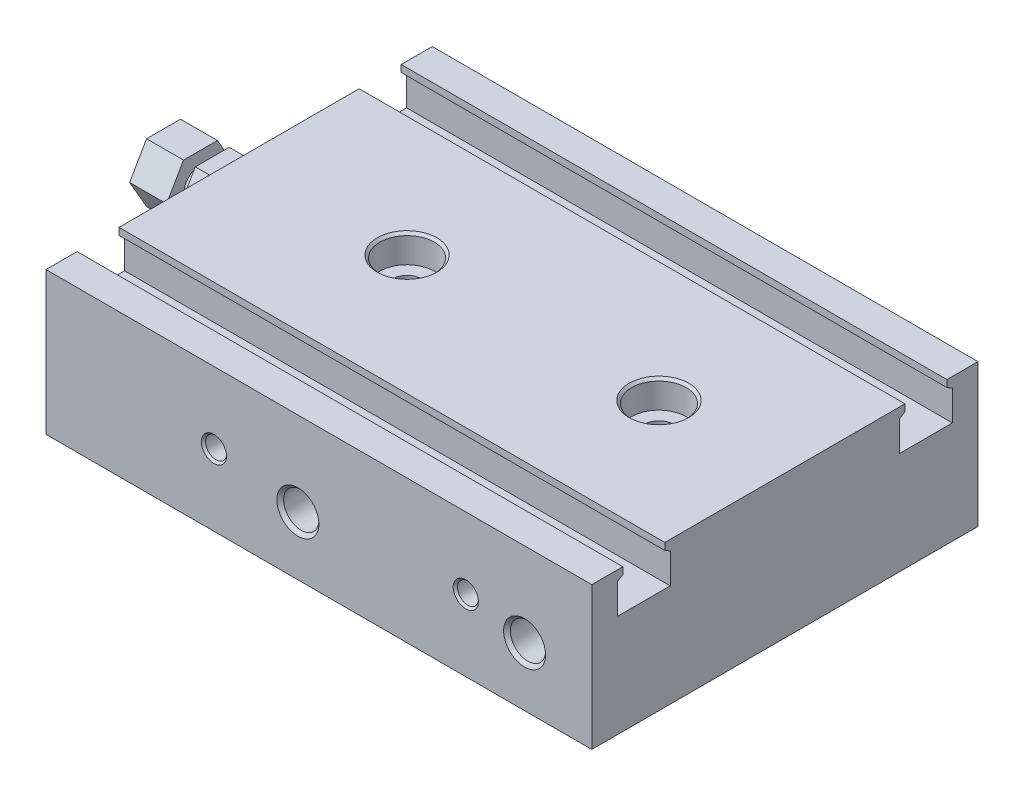
from build123d import *

# Parameters (mm, degrees)
BODY_SKETCH_W                                = 46
BODY_SKETCH_H                                = 17
BODY_DEPTH                                   = 65
BODY_ROD_HOLES_SKETCH_R                      = 3
BODY_ROD_HOLES_DEPTH                         = 10
BODY_PISTON_HOLES_SKETCH_R                   = 4.05
BODY_PISTON_HOLES_DEPTH                      = 11
TOP_SWITCH_GROOVES_DEPTH                     = 70.670653793
SHCS_MGT_HOLE_CHAM_SIZE                      = 0.3
SHCS_MGT_HOLE_PAT_COUNT                      = 2
SHCS_MGT_HOLE_PAT_PITCH                      = 30
SHCS_MGT_HOLE_CHAM_OF_SHCS_MGT_HOLE_PAT_SIZE = 0.3
SHCS_MGT_HOLE_BOT_TAP_AT_2_COUNT             = 2
SHCS_MGT_HOLE_BOT_TAP_AT_2_PITCH             = 30
ADJUSTER_NUT_DEPTH                           = 9
ADJUSTER_NUT_THREADS_SKETCH_W                = 1.4
ADJUSTER_NUT_THREADS_SKETCH_H                = 17
TAP_DRILL_FOR_M5X0_8_TAP1_D                  = 4.2
TAP_DRILL_FOR_M5X0_8_TAP1_DEPTH              = 4.5
TAP_DRILL_FOR_M5X0_8_TAP1_CSINK_D            = 5
TAP_DRILL_FOR_M5X0_8_TAP1_CSINK_ANGLE        = 90
TAP_DRILL_FOR_M5X0_8_TAP1_TIP                = 1.2618073
TAP_DRILL_FOR_M5X0_8_TAP2_D                  = 4.2
TAP_DRILL_FOR_M5X0_8_TAP2_DEPTH              = 4.5
TAP_DRILL_FOR_M5X0_8_TAP2_CSINK_D            = 5
TAP_DRILL_FOR_M5X0_8_TAP2_CSINK_ANGLE        = 90
TAP_DRILL_FOR_M5X0_8_TAP2_TIP                = 1.2618073
MOUNT_HOLES_1_D                              = 2.5
MOUNT_HOLES_1_DEPTH                          = 4.5
MOUNT_HOLES_1_CSINK_D                        = 3
MOUNT_HOLES_1_CSINK_ANGLE                    = 90
MOUNT_HOLES_1_TIP                            = 0.751075774
MOUNT_HOLES_2_D                              = 2.5
MOUNT_HOLES_2_DEPTH                          = 4.5
MOUNT_HOLES_2_CSINK_D                        = 3
MOUNT_HOLES_2_CSINK_ANGLE                    = 90
MOUNT_HOLES_2_TIP                            = 0.751075774


with BuildPart() as part:
    # Body_Sketch → Body (new body)
    with BuildSketch(Plane(origin=(0, 0, 0), x_dir=(0, 0, -1), z_dir=(1, 0, 0))):
        with Locations((0, 1.5)):
            Rectangle(BODY_SKETCH_W, BODY_SKETCH_H)
    extrude(amount=BODY_DEPTH)

    # Body Rod Holes_Sketch → Body Rod Holes (cut)
    with BuildSketch(Plane.ZY):
        with Locations((-10, 0)):
            Circle(BODY_ROD_HOLES_SKETCH_R)
        with Locations(Location((10, 0, 0), (0, 0, 180))):
            Circle(BODY_ROD_HOLES_SKETCH_R)
    extrude(amount=-BODY_ROD_HOLES_DEPTH, mode=Mode.SUBTRACT)

    # Body Piston Holes_Sketch → Body Piston Holes (cut)
    with BuildSketch(Plane.ZY.offset(-10)):
        with Locations((10, 0)):
            Circle(BODY_PISTON_HOLES_SKETCH_R)
        with Locations((-10, 0)):
            Circle(BODY_PISTON_HOLES_SKETCH_R)
    extrude(amount=-BODY_PISTON_HOLES_DEPTH, mode=Mode.SUBTRACT)

    # Top Switch Grooves_Sketch → Top Switch Grooves (cut, through all)
    with BuildSketch(Plane.ZY):
        Polygon((13.65, 5.2), (19.95, 5.2), (19.95, 8.8), (19.3, 9.175277675), (19.3, 10), (14.3, 10), (14.3, 9.175277675), (13.65, 8.8), align=None)
        Polygon((-13.65, 8.8), (-13.65, 5.2), (-19.95, 5.2), (-19.95, 8.8), (-19.3, 9.175277675), (-19.3, 10), (-14.3, 10), (-14.3, 9.175277675), align=None)
    extrude(amount=-TOP_SWITCH_GROOVES_DEPTH, mode=Mode.SUBTRACT)

    # SHCS MGT Hole_Sketch → SHCS MGT Hole (revolve, cut)
    with BuildSketch(Plane.XY, mode=Mode.PRIVATE) as shcs_mgt_hole_sk:
        Polygon((20, 10), (16.75, 10), (16.75, 6.7), (18.3, 6.7), (18.3, -7), (20, -7), align=None)
    shcs_mgt_hole = revolve(shcs_mgt_hole_sk.sketch.rotate(Axis((20, -11.506886035, 0), (0, 1, 0)), 270), axis=Axis((20, -11.506886035, 0), (0, 1, 0)), mode=Mode.SUBTRACT)

    # SHCS MGT Hole Cham
    shcs_mgt_hole_cham_edges = [part.edges().sort_by_distance(p)[0] for p in [
        (20, 10, 3.25),
    ]]
    chamfer(shcs_mgt_hole_cham_edges, length=SHCS_MGT_HOLE_CHAM_SIZE)

    # SHCS MGT Hole Pat: SHCS MGT Hole ×2
    with Locations(*[(i * SHCS_MGT_HOLE_PAT_PITCH, 0, 0) for i in range(1, SHCS_MGT_HOLE_PAT_COUNT)]):
        add(shcs_mgt_hole, mode=Mode.SUBTRACT)

    # SHCS MGT Hole Cham of SHCS MGT Hole Pat
    shcs_mgt_hole_cham_of_shcs_mgt_hole_pat_edges = [part.edges().sort_by_distance(p)[0] for p in [
        (50, 10, 3.25),
    ]]
    chamfer(shcs_mgt_hole_cham_of_shcs_mgt_hole_pat_edges, length=SHCS_MGT_HOLE_CHAM_OF_SHCS_MGT_HOLE_PAT_SIZE)

    # SHCS MGT Hole Bot Tap Profile → SHCS MGT Hole Bot Tap (revolve, cut)
    with BuildSketch(Plane(origin=(20, -7, 0), x_dir=(0, 0, -1), z_dir=(1, 0, 0))):
        Polygon((0, 0), (0, 9.021463052), (1.7, 8), (1.7, 7), (2, 7), (2, 0.3), (2.3, 0), align=None)
    shcs_mgt_hole_bot_tap = revolve(axis=Axis((20, -13.35, 0), (0, 1, 0)), mode=Mode.SUBTRACT)

    # SHCS MGT Hole Bot Tap at 2: SHCS MGT Hole Bot Tap ×2
    with Locations(*[(i * SHCS_MGT_HOLE_BOT_TAP_AT_2_PITCH, 0, 0) for i in range(1, SHCS_MGT_HOLE_BOT_TAP_AT_2_COUNT)]):
        add(shcs_mgt_hole_bot_tap, mode=Mode.SUBTRACT)

    # Adjuster Nut_Sketch → Adjuster Nut (add)
    with BuildSketch(Plane.ZY):
        Polygon((-2.020725942, 8.5), (2.020725942, 8.5), (4.041451884, 5), (2.020725942, 1.5), (-2.020725942, 1.5), (-4.041451884, 5), align=None)
    extrude(amount=ADJUSTER_NUT_DEPTH)

    # Adjuster Nut Threads_Sketch → Adjuster Nut Threads (revolve, cut)
    with BuildSketch(Plane.XY, mode=Mode.PRIVATE) as adjuster_nut_threads_sk:
        with Locations((-3.9, 15.5)):
            Rectangle(ADJUSTER_NUT_THREADS_SKETCH_W, ADJUSTER_NUT_THREADS_SKETCH_H)
    revolve(adjuster_nut_threads_sk.sketch.rotate(Axis((-6.476, 5, 0), (1, 0, 0)), 270), axis=Axis((-6.476, 5, 0), (1, 0, 0)), mode=Mode.SUBTRACT)

    # Tap Drill for M5x0.8 Tap1
    with Locations(Plane.XY.offset(23)):
        with Locations((30, 0), (57, 0)):
            CounterSinkHole(TAP_DRILL_FOR_M5X0_8_TAP1_D / 2, TAP_DRILL_FOR_M5X0_8_TAP1_CSINK_D / 2, depth=TAP_DRILL_FOR_M5X0_8_TAP1_DEPTH, counter_sink_angle=TAP_DRILL_FOR_M5X0_8_TAP1_CSINK_ANGLE)
            with Locations((0, 0, -(TAP_DRILL_FOR_M5X0_8_TAP1_DEPTH + TAP_DRILL_FOR_M5X0_8_TAP1_TIP / 2))):  # 118° drill point
                Cone(0, TAP_DRILL_FOR_M5X0_8_TAP1_D / 2, TAP_DRILL_FOR_M5X0_8_TAP1_TIP, mode=Mode.SUBTRACT)

    # Tap Drill for M5x0.8 Tap2
    with Locations(Plane(origin=(0, 0, -23), x_dir=(-1, 0, 0), z_dir=(0, 0, -1))):
        with Locations((-57, 0), (-30, 0)):
            CounterSinkHole(TAP_DRILL_FOR_M5X0_8_TAP2_D / 2, TAP_DRILL_FOR_M5X0_8_TAP2_CSINK_D / 2, depth=TAP_DRILL_FOR_M5X0_8_TAP2_DEPTH, counter_sink_angle=TAP_DRILL_FOR_M5X0_8_TAP2_CSINK_ANGLE)
            with Locations((0, 0, -(TAP_DRILL_FOR_M5X0_8_TAP2_DEPTH + TAP_DRILL_FOR_M5X0_8_TAP2_TIP / 2))):  # 118° drill point
                Cone(0, TAP_DRILL_FOR_M5X0_8_TAP2_D / 2, TAP_DRILL_FOR_M5X0_8_TAP2_TIP, mode=Mode.SUBTRACT)

    # Mount_Holes_1
    with Locations(Plane.XY.offset(23)):
        with Locations((20, 1.5), (50, 1.5)):
            CounterSinkHole(MOUNT_HOLES_1_D / 2, MOUNT_HOLES_1_CSINK_D / 2, depth=MOUNT_HOLES_1_DEPTH, counter_sink_angle=MOUNT_HOLES_1_CSINK_ANGLE)
            with Locations((0, 0, -(MOUNT_HOLES_1_DEPTH + MOUNT_HOLES_1_TIP / 2))):  # 118° drill point
                Cone(0, MOUNT_HOLES_1_D / 2, MOUNT_HOLES_1_TIP, mode=Mode.SUBTRACT)

    # Mount_Holes_2
    with Locations(Plane(origin=(0, 0, -23), x_dir=(-1, 0, 0), z_dir=(0, 0, -1))):
        with Locations((-50, 1.5), (-20, 1.5)):
            CounterSinkHole(MOUNT_HOLES_2_D / 2, MOUNT_HOLES_2_CSINK_D / 2, depth=MOUNT_HOLES_2_DEPTH, counter_sink_angle=MOUNT_HOLES_2_CSINK_ANGLE)
            with Locations((0, 0, -(MOUNT_HOLES_2_DEPTH + MOUNT_HOLES_2_TIP / 2))):  # 118° drill point
                Cone(0, MOUNT_HOLES_2_D / 2, MOUNT_HOLES_2_TIP, mode=Mode.SUBTRACT)


solid = part.part
